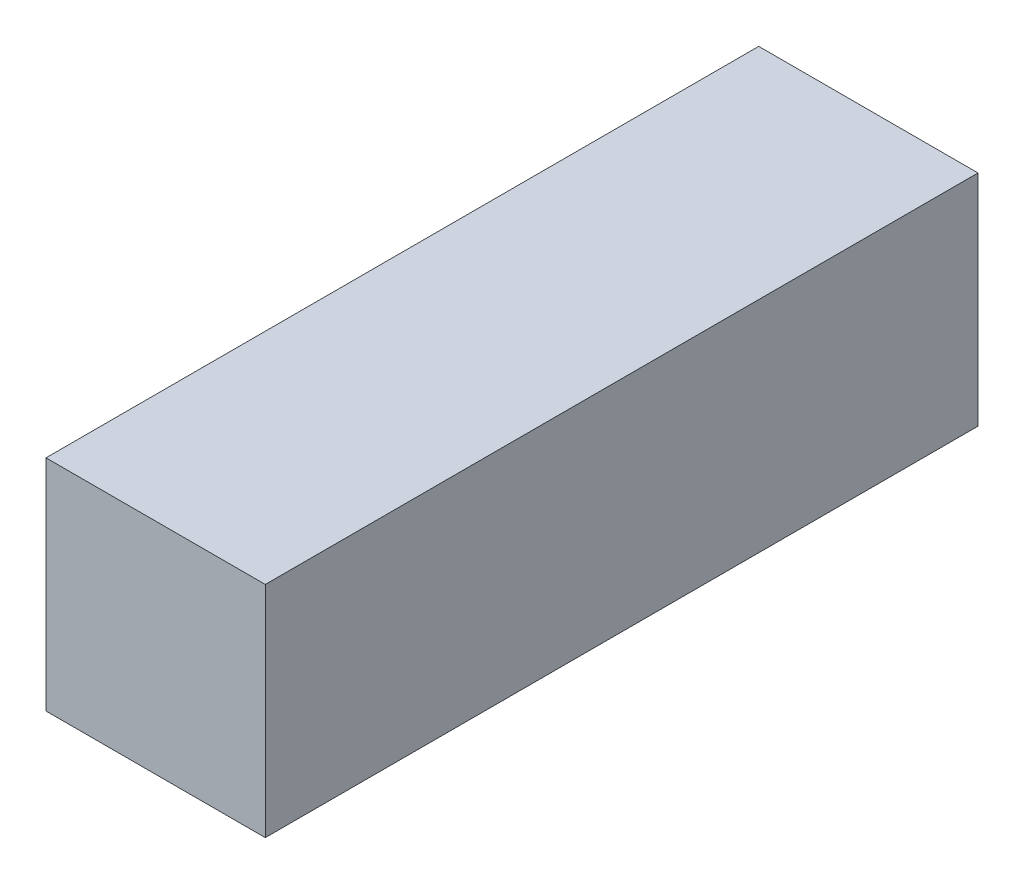
from build123d import *

# Parameters (mm, degrees)
SKETCH1_W           = 20
SKETCH1_H           = 20
BOSS_EXTRUDE1_DEPTH = 65


with BuildPart() as part:
    # Sketch1 → Boss-Extrude1 (new body)
    with BuildSketch(Plane.XY):
        Rectangle(SKETCH1_W, SKETCH1_H)
    extrude(amount=BOSS_EXTRUDE1_DEPTH)


solid = part.part
